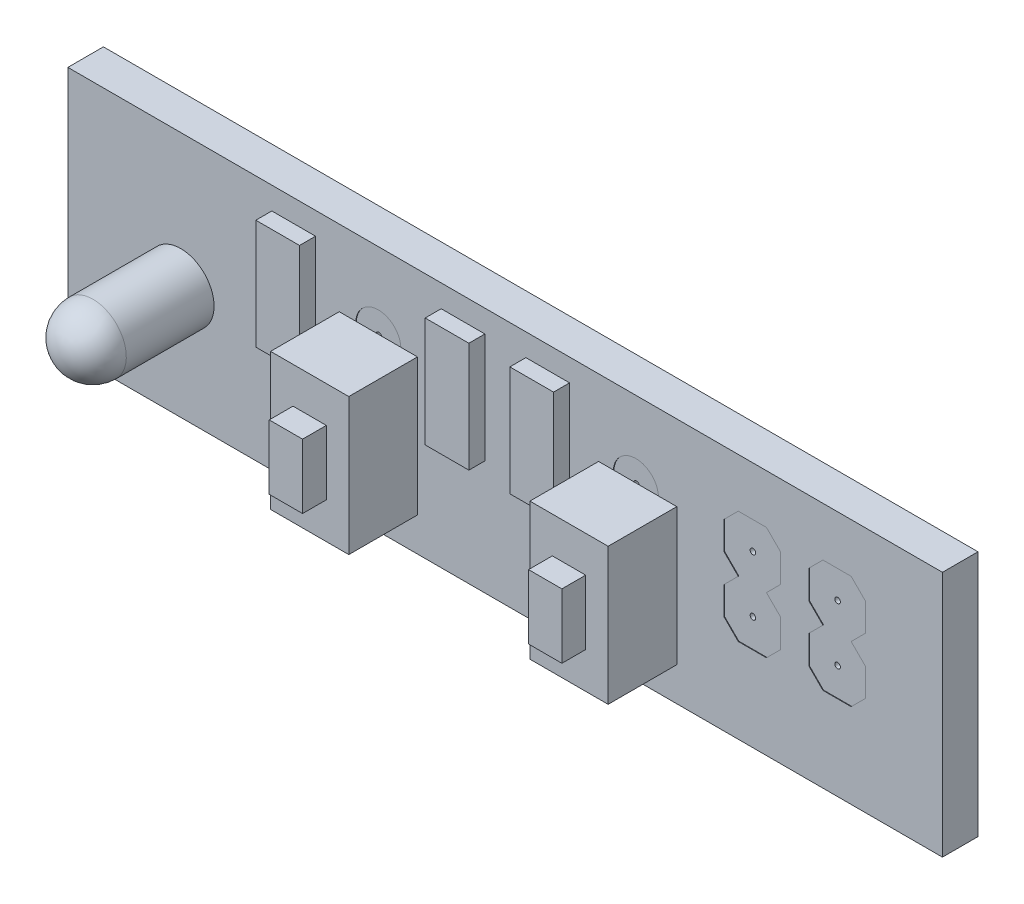
from build123d import *

# Parameters (mm, degrees)
SKETCH2_W           = 39.35
SKETCH2_H           = 11.1
BOSS_EXTRUDE1_DEPTH = 1.6
SKETCH3_W           = 1.966
SKETCH3_H           = 4.946
BOSS_EXTRUDE2_DEPTH = 0.72
SKETCH4_R           = 1.016
CUT_EXTRUDE1_DEPTH  = 0.0254
SKETCH4_3_R         = 0.13
CUT_EXTRUDE2_DEPTH  = 41.916897487
CUT_EXTRUDE3_DEPTH  = 0.0254
SKETCH6_R           = 0.125
CUT_EXTRUDE4_DEPTH  = 41.915912127
SKETCH8_W           = 3.52
SKETCH8_H           = 6.16
BOSS_EXTRUDE3_DEPTH = 3.09
SKETCH9_W           = 1.5
SKETCH9_H           = 2.9
BOSS_EXTRUDE4_DEPTH = 1.07
LPATTERN1_COUNT     = 2
LPATTERN1_PITCH     = 11.668100108


with BuildPart() as part:
    # Sketch2 → Boss-Extrude1 (new body)
    with BuildSketch(Plane.XY):
        with Locations((19.675, 5.55)):
            Rectangle(SKETCH2_W, SKETCH2_H)
    extrude(amount=-BOSS_EXTRUDE1_DEPTH)

    # Sketch3 → Boss-Extrude2 (add)
    with BuildSketch(Plane.XY):
        with Locations((10.16, 7.62)):
            Rectangle(SKETCH3_W, SKETCH3_H)
        with Locations((17.78, 7.62)):
            Rectangle(SKETCH3_W, SKETCH3_H)
        with Locations((21.59, 7.62)):
            Rectangle(SKETCH3_W, SKETCH3_H)
    extrude(amount=BOSS_EXTRUDE2_DEPTH)

    # Sketch4 → Cut-Extrude1 (cut)
    with BuildSketch(Plane.XY):
        with Locations((13.97, 1.5875)):
            Circle(SKETCH4_R)
        with Locations((13.97, 7.62)):
            Circle(SKETCH4_R)
        with Locations((25.5587, 7.62)):
            Circle(SKETCH4_R)
        with Locations((25.6381, 1.5875)):
            Circle(SKETCH4_R)
    extrude(amount=-CUT_EXTRUDE1_DEPTH, mode=Mode.SUBTRACT)

    # Sketch4<3> → Cut-Extrude2 (cut, through all)
    with BuildSketch(Plane.XY):
        with Locations((13.97, 1.5875)):
            Circle(SKETCH4_3_R)
        with Locations((13.97, 7.62)):
            Circle(SKETCH4_3_R)
        with Locations((25.5587, 7.62)):
            Circle(SKETCH4_3_R)
        with Locations((25.6381, 1.5875)):
            Circle(SKETCH4_3_R)
    extrude(amount=-CUT_EXTRUDE2_DEPTH, mode=Mode.SUBTRACT)

    # Sketch5 → Cut-Extrude3 (cut)
    with BuildSketch(Plane.XY):
        Polygon((29.5275, 6.985), (29.5275, 8.255), (30.1625, 8.89), (31.4325, 8.89), (32.0675, 8.255), (32.0675, 6.985), (31.4325, 6.35), (32.0675, 5.715), (32.0675, 4.445), (31.4325, 3.81), (30.1625, 3.81), (29.5275, 4.445), (29.5275, 5.715), (30.1625, 6.35), align=None)
        Polygon((33.3375, 4.445), (33.3375, 5.715), (33.9725, 6.35), (33.3375, 6.985), (33.3375, 8.255), (33.9725, 8.89), (35.2425, 8.89), (35.8775, 8.255), (35.8775, 6.985), (35.2425, 6.35), (35.8775, 5.715), (35.8775, 4.445), (35.2425, 3.81), (33.9725, 3.81), align=None)
    extrude(amount=-CUT_EXTRUDE3_DEPTH, mode=Mode.SUBTRACT)

    # Sketch6 → Cut-Extrude4 (cut, through all)
    with BuildSketch(Plane.XY.offset(-0.0254)):
        with Locations((30.7975, 7.62)):
            Circle(SKETCH6_R)
        with Locations((30.7975, 5.08)):
            Circle(SKETCH6_R)
        with Locations((34.6075, 5.08)):
            Circle(SKETCH6_R)
        with Locations((34.6075, 7.62)):
            Circle(SKETCH6_R)
    extrude(amount=-CUT_EXTRUDE4_DEPTH, mode=Mode.SUBTRACT)

    # Sketch8 → Boss-Extrude3 (add)
    with BuildSketch(Plane.XY):
        with Locations((13.97, 4.60375)):
            Rectangle(SKETCH8_W, SKETCH8_H)
    boss_extrude3 = extrude(amount=BOSS_EXTRUDE3_DEPTH)

    # Sketch9 → Boss-Extrude4 (add)
    with BuildSketch(Plane.XY.offset(3.09)):
        with Locations((13.97, 4.60375)):
            Rectangle(SKETCH9_W, SKETCH9_H)
    boss_extrude4 = extrude(amount=BOSS_EXTRUDE4_DEPTH)

    # LPattern1: Boss-Extrude3, Boss-Extrude4 ×2
    with Locations(*[(i * LPATTERN1_PITCH, 0, 0) for i in range(1, LPATTERN1_COUNT)]):
        add(boss_extrude3)
        add(boss_extrude4)

    # Sketch11 → Revolve18 (revolve)
    with BuildSketch(Plane.ZY.offset(-5.079644146)):
        with BuildLine():
            Line((0, 5.08), (0, 6.58))
            Line((0, 6.58), (3.95, 6.58))
            ThreePointArc((3.95, 6.58), (5.010660172, 6.140660172), (5.45, 5.08))
            Line((5.45, 5.08), (0, 5.08))
        make_face()
    revolve(axis=Axis((5.079644146, 5.08, 0), (0, 0, 1)))


solid = part.part
